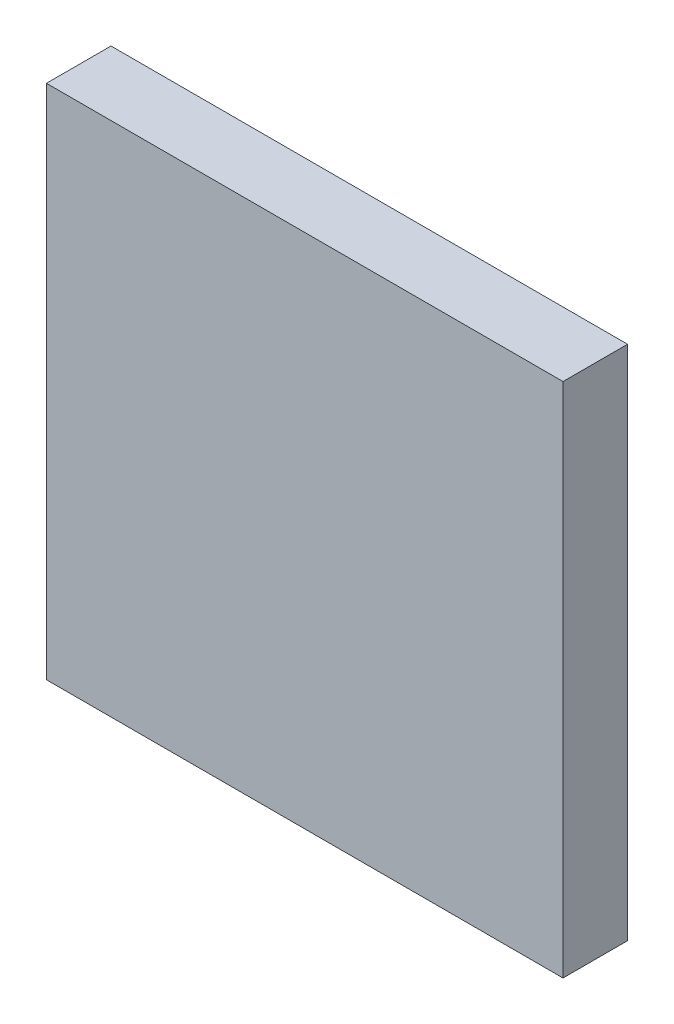
from build123d import *

# Parameters (mm, degrees)
SKETCH1_W     = 8
SKETCH1_H     = 8
PROFILE_DEPTH = 1


with BuildPart() as part:
    # Sketch1 → Profile (new body)
    with BuildSketch(Plane.XY):
        with Locations((4, 4)):
            Rectangle(SKETCH1_W, SKETCH1_H)
    extrude(amount=PROFILE_DEPTH)


solid = part.part
